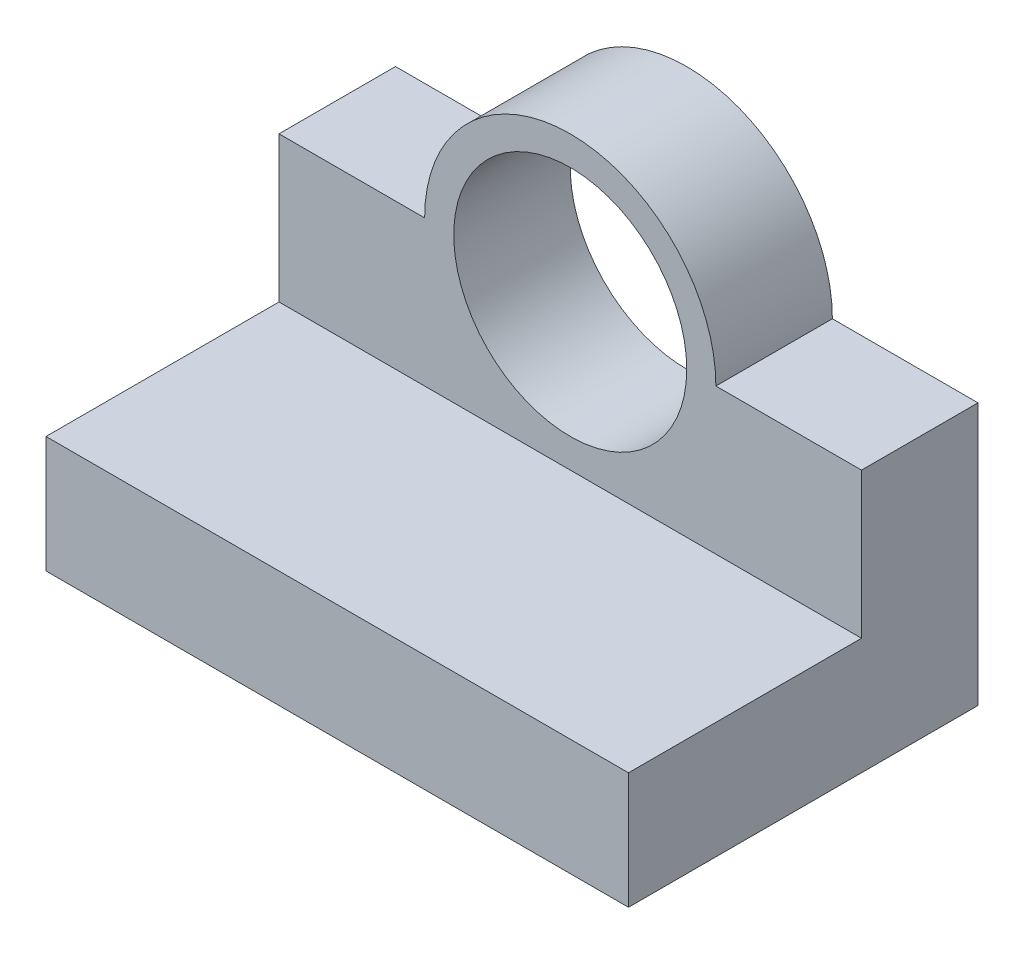
from build123d import *

# Parameters (mm, degrees)
SKETCH1_R           = 20
BOSS_EXTRUDE1_DEPTH = 10
SKETCH2_W           = 100
SKETCH2_H           = 20
BOSS_EXTRUDE2_DEPTH = 40


with BuildPart() as part:
    # Sketch1 → Boss-Extrude1 (new, symmetric)
    with BuildSketch(Plane.XY):
        with BuildLine():
            Line((25, 45), (50, 45))
            Line((50, 45), (50, 0))
            Line((50, 0), (-50, 0))
            Line((-50, 0), (-50, 45))
            Line((-50, 45), (-25, 45))
            ThreePointArc((-25, 45), (0, 70), (25, 45))
        make_face()
        with Locations((0, 45)):
            Circle(SKETCH1_R, mode=Mode.SUBTRACT)
    extrude(amount=BOSS_EXTRUDE1_DEPTH, both=True)

    # Sketch2 → Boss-Extrude2 (add)
    with BuildSketch(Plane.XY.offset(10)):
        with Locations((0, 10)):
            Rectangle(SKETCH2_W, SKETCH2_H)
    extrude(amount=BOSS_EXTRUDE2_DEPTH)


solid = part.part
